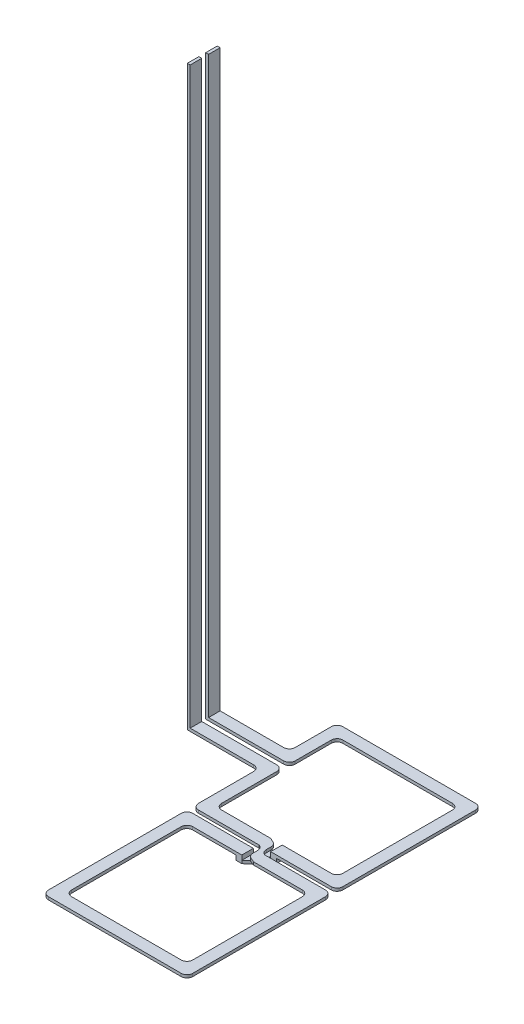
from build123d import *

# Parameters (mm, degrees)
EXTRUDE_1_DEPTH          = 0.5
EXTRUDE_1_2_DEPTH        = 0.5
CUT_EXTRUDE_1_DEPTH      = 10
CUT_EXTRUDE_1_DEPTH_BACK = 10
SKETCH_2_W               = 2
SKETCH_2_H               = 9.01144146
EXTRUDE_2_DEPTH          = 0.5
SKETCH_4_W               = 1
SKETCH_4_H               = 2
EXTRUDE_3_DEPTH          = 0.8
EXTRUDE_4_DEPTH          = 0.5
SKETCH_6_W               = 0.5
SKETCH_6_H               = 2
EXTRUDE_5_DEPTH          = 100


with BuildPart() as part:
    # 草图1 → 凸台-拉伸1 (new body)
    with BuildSketch(Plane(origin=(0, 0, 0), x_dir=(1, 0, 0), z_dir=(0, 1, 0))):
        with BuildLine():
            Line((-9.5, 23.5), (9.5, 23.5))
            ThreePointArc((9.5, 23.5), (10.207106781, 23.207106781), (10.5, 22.5))
            Line((10.5, 22.5), (10.5, 3.5))
            ThreePointArc((10.5, 3.5), (10.207106781, 2.792893219), (9.5, 2.5))
            Line((9.5, 2.5), (-9.5, 2.5))
            ThreePointArc((-9.5, 2.5), (-10.207106781, 2.792893219), (-10.5, 3.5))
            Line((-10.5, 3.5), (-10.5, 13.058292323))
            ThreePointArc((-10.5, 13.058292323), (-10.792893219, 13.765399104), (-11.5, 14.058292323))
            Line((-11.5, 14.058292323), (-25, 14.058292323))
            Line((-25, 14.058292323), (-25, 12.058292323))
            Line((-25, 12.058292323), (-13.5, 12.058292323))
            ThreePointArc((-13.5, 12.058292323), (-12.792893219, 11.765399104), (-12.5, 11.058292323))
            Line((-12.5, 11.058292323), (-12.5, 1.5))
            ThreePointArc((-12.5, 1.5), (-12.207106781, 0.792893219), (-11.5, 0.5))
            Line((-11.5, 0.5), (11.5, 0.5))
            ThreePointArc((11.5, 0.5), (12.207106781, 0.792893219), (12.5, 1.5))
            Line((12.5, 1.5), (12.5, 24.5))
            ThreePointArc((12.5, 24.5), (12.207106781, 25.207106781), (11.5, 25.5))
            Line((11.5, 25.5), (-11.5, 25.5))
            ThreePointArc((-11.5, 25.5), (-12.207106781, 25.207106781), (-12.5, 24.5))
            Line((-12.5, 24.5), (-12.5, 18.246362536))
            ThreePointArc((-12.5, 18.246362536), (-12.792893219, 17.539255755), (-13.5, 17.246362536))
            Line((-13.5, 17.246362536), (-25, 17.246362536))
            Line((-25, 17.246362536), (-25, 15.246362536))
            Line((-25, 15.246362536), (-11.5, 15.246362536))
            ThreePointArc((-11.5, 15.246362536), (-10.792893219, 15.539255755), (-10.5, 16.246362536))
            Line((-10.5, 16.246362536), (-10.5, 22.5))
            ThreePointArc((-10.5, 22.5), (-10.207106781, 23.207106781), (-9.5, 23.5))
        make_face()
    extrude(amount=EXTRUDE_1_DEPTH)


with BuildPart() as body_2:
    # 草图1 → Extrude 1 2 (new body)
    with BuildSketch(Plane(origin=(0, 0, 0), x_dir=(1, 0, 0), z_dir=(0, 1, 0))):
        with BuildLine():
            Line((-11.5, -0.5), (11.5, -0.5))
            ThreePointArc((11.5, -0.5), (12.207106781, -0.792893219), (12.5, -1.5))
            Line((12.5, -1.5), (12.5, -24.5))
            ThreePointArc((12.5, -24.5), (12.207106781, -25.207106781), (11.5, -25.5))
            Line((11.5, -25.5), (-11.5, -25.5))
            ThreePointArc((-11.5, -25.5), (-12.207106781, -25.207106781), (-12.5, -24.5))
            Line((-12.5, -24.5), (-12.5, -1.5))
            ThreePointArc((-12.5, -1.5), (-12.207106781, -0.792893219), (-11.5, -0.5))
        make_face()
        with BuildLine():
            Line((-9.5, -2.5), (9.5, -2.5))
            ThreePointArc((9.5, -2.5), (10.207106781, -2.792893219), (10.5, -3.5))
            Line((10.5, -3.5), (10.5, -22.5))
            ThreePointArc((10.5, -22.5), (10.207106781, -23.207106781), (9.5, -23.5))
            Line((9.5, -23.5), (-9.5, -23.5))
            ThreePointArc((-9.5, -23.5), (-10.207106781, -23.207106781), (-10.5, -22.5))
            Line((-10.5, -22.5), (-10.5, -3.5))
            ThreePointArc((-10.5, -3.5), (-10.207106781, -2.792893219), (-9.5, -2.5))
        make_face(mode=Mode.SUBTRACT)
    extrude(amount=EXTRUDE_1_2_DEPTH)


with BuildPart() as cut_extrude_1_tool:
    # 草图2 → 切除-拉伸1 (new, two sides: drawn at the far end of the back side and taken through both)
    with BuildSketch(Plane(origin=(0, 0, 0), x_dir=(1, 0, 0), z_dir=(0, 1, 0)).offset(-CUT_EXTRUDE_1_DEPTH_BACK)):
        Rectangle(SKETCH_2_W, SKETCH_2_H)
    extrude(amount=CUT_EXTRUDE_1_DEPTH + CUT_EXTRUDE_1_DEPTH_BACK)


with BuildPart() as part_1:
    add(part.part)

    # 切除-拉伸1: cut by cut_extrude_1_tool
    add(cut_extrude_1_tool.part, mode=Mode.SUBTRACT)



with BuildPart() as body_2_1:
    add(body_2.part)

    # 切除-拉伸1: cut by cut_extrude_1_tool
    add(cut_extrude_1_tool.part, mode=Mode.SUBTRACT)


with BuildPart() as part_2:
    add(part_1.part)

    add(body_2_1.part)  # 凸台-拉伸2 merges body 2
    # 草图3 → 凸台-拉伸2 (add)
    with BuildSketch(Plane(origin=(0, 0, 0), x_dir=(1, 0, 0), z_dir=(0, 1, 0))):
        with BuildLine():
            Line((-1, 2.5), (-0.28379779, 2.176260251))
            ThreePointArc((-0.28379779, 2.176260251), (0.144512655, 1.807294997), (0.304305253, 1.265029821))
            Line((0.304305253, 1.265029821), (0.304305253, 0.459864337))
            ThreePointArc((0.304305253, 0.459864337), (0.46409785, -0.082400839), (0.892408295, -0.451366093))
            Line((0.892408295, -0.451366093), (1, -0.5))
            Line((1, -0.5), (1, -2.5))
            Line((1, -2.5), (0.28379779, -2.176260251))
            ThreePointArc((0.28379779, -2.176260251), (-0.144512655, -1.807294997), (-0.304305253, -1.265029821))
            Line((-0.304305253, -1.265029821), (-0.304305253, -0.459864337))
            ThreePointArc((-0.304305253, -0.459864337), (-0.46409785, 0.082400839), (-0.892408295, 0.451366093))
            Line((-0.892408295, 0.451366093), (-1, 0.5))
            Line((-1, 0.5), (-1, 2.5))
        make_face()
    extrude(amount=EXTRUDE_2_DEPTH)

    # 草图4 → 凸台-拉伸3 (add)
    with BuildSketch(Plane(origin=(0, 0, 0), x_dir=(1, 0, 0), z_dir=(0, 1, 0))):
        with Locations((-1.5, -1.5)):
            Rectangle(SKETCH_4_W, SKETCH_4_H)
        with Locations((1.5, 1.5)):
            Rectangle(SKETCH_4_W, SKETCH_4_H)
    extrude(amount=-EXTRUDE_3_DEPTH)

    # 草图5 → 凸台-拉伸4 (add)
    with BuildSketch(Plane(origin=(0, -0.8, 0), x_dir=(1, 0, 0), z_dir=(0, 1, 0))):
        with BuildLine():
            Line((-1, -2.5), (0.08384733, -1.594586619))
            ThreePointArc((0.08384733, -1.594586619), (0.348584902, -1.250746207), (0.442741007, -0.827134547))
            Line((0.442741007, -0.827134547), (0.442741007, -0.433160476))
            ThreePointArc((0.442741007, -0.433160476), (0.536897113, -0.009548815), (0.801634685, 0.334291597))
            Line((0.801634685, 0.334291597), (1, 0.5))
            Line((1, 0.5), (1, 2.5))
            Line((1, 2.5), (-0.08384733, 1.594586619))
            ThreePointArc((-0.08384733, 1.594586619), (-0.348584902, 1.250746207), (-0.442741007, 0.827134547))
            Line((-0.442741007, 0.827134547), (-0.442741007, 0.433160476))
            ThreePointArc((-0.442741007, 0.433160476), (-0.536897113, 0.009548815), (-0.801634685, -0.334291597))
            Line((-0.801634685, -0.334291597), (-1, -0.5))
            Line((-1, -0.5), (-1, -2.5))
        make_face()
    extrude(amount=EXTRUDE_4_DEPTH)

    # 草图6 → 凸台-拉伸5 (add)
    with BuildSketch(Plane(origin=(0, 0, 0), x_dir=(1, 0, 0), z_dir=(0, 1, 0))):
        with Locations((-24.75, 16.246362536)):
            Rectangle(SKETCH_6_W, SKETCH_6_H)
        with Locations((-24.75, 13.058292323)):
            Rectangle(SKETCH_6_W, SKETCH_6_H)
    extrude(amount=EXTRUDE_5_DEPTH)


solid = part_2.part
